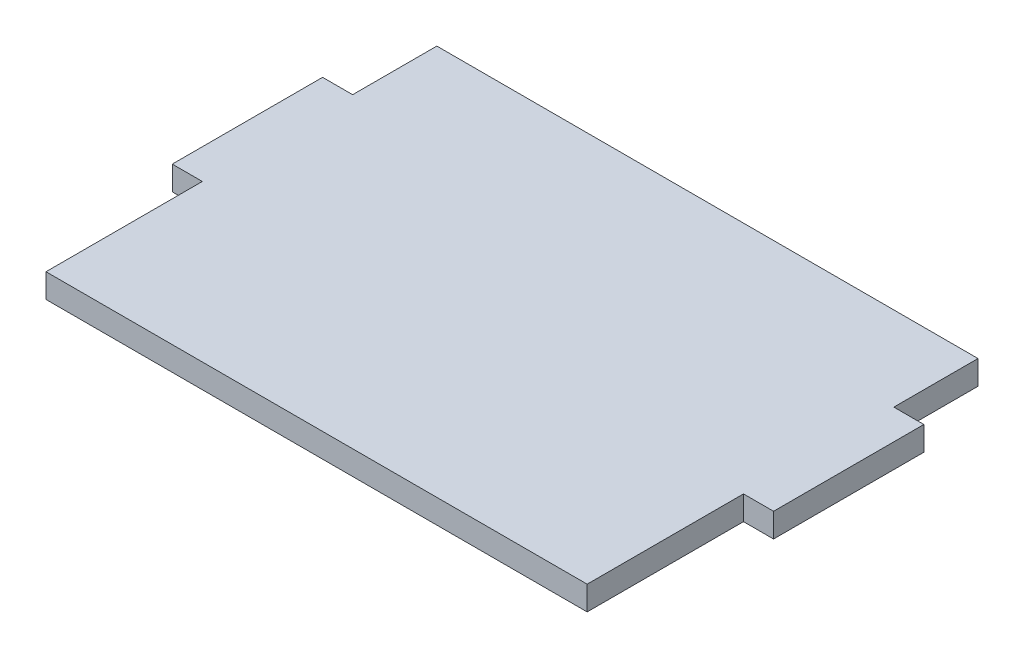
from build123d import *

# Parameters (mm, degrees)
SALIENTE_EXTRUIR1_DEPTH = 4


with BuildPart() as part:
    # Croquis1 → Saliente-Extruir1 (new body)
    with BuildSketch(Plane(origin=(0, 0, 0), x_dir=(1, 0, 0), z_dir=(0, 1, 0))):
        Polygon((-45, -32.5), (45, -32.5), (45, -6.5), (50, -6.5), (50, 18.5), (45, 18.5), (45, 32.5), (-45, 32.5), (-45, 18.5), (-50, 18.5), (-50, -6.5), (-45, -6.5), align=None)
    extrude(amount=SALIENTE_EXTRUIR1_DEPTH)


solid = part.part
